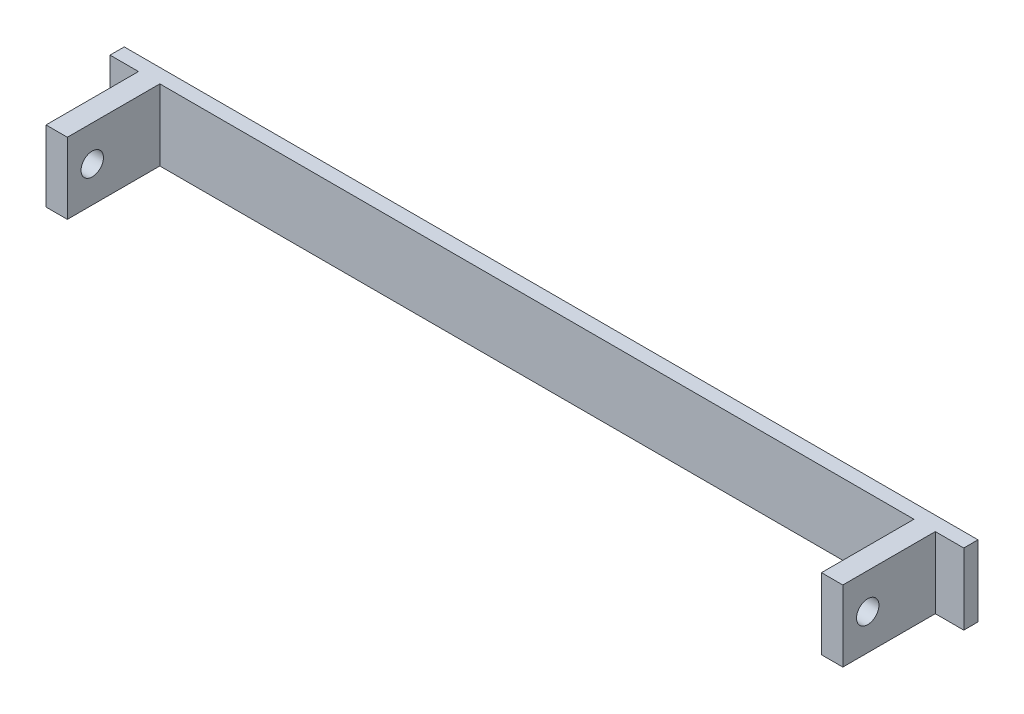
from build123d import *

# Parameters (mm, degrees)
SKETCH_1_W          = 120
SKETCH_1_H          = 10
EXTRUDE_1_DEPTH     = 2
SKETCH_2_W          = 3
SKETCH_2_H          = 10
EXTRUDE_2_DEPTH     = 13
CUT_EXTRUDE_1_REACH = 119.073
SKETCH_3_R          = 1.575


with BuildPart() as part:
    # 草图1 → 凸台-拉伸1 (new body)
    with BuildSketch(Plane.XY):
        Rectangle(SKETCH_1_W, SKETCH_1_H)
    extrude(amount=EXTRUDE_1_DEPTH)

    # 草图2 → 凸台-拉伸2 (add)
    with BuildSketch(Plane.XY.offset(2)):
        with Locations((-54.5, 0)):
            Rectangle(SKETCH_2_W, SKETCH_2_H)
        with Locations((54.5, 0)):
            Rectangle(SKETCH_2_W, SKETCH_2_H)
    extrude(amount=EXTRUDE_2_DEPTH)

    # 切除-拉伸1: up to this face of the body (flat: up to its plane)
    cut_extrude_1_end = Plane(part.part.faces().sort_by_distance((-56, 0, 8.5))[0])
    # 草图3 → 切除-拉伸1 (cut, up to the picked face)
    with BuildSketch(Plane(origin=(56, 0, 0), x_dir=(0, 0, -1), z_dir=(1, 0, 0)), mode=Mode.PRIVATE) as cut_extrude_1_sk1:
        with Locations(Location((-11.5, 0, 0), (0, 0, 90))):
            Circle(SKETCH_3_R)
    cut_extrude_1_tool1 = split(extrude(cut_extrude_1_sk1.sketch, amount=-CUT_EXTRUDE_1_REACH, mode=Mode.PRIVATE), bisect_by=cut_extrude_1_end, keep=Keep.BOTH, mode=Mode.PRIVATE)
    add(cut_extrude_1_tool1.solids().sort_by(Axis((56, 0, 11.5), (-1, 0, 0)))[0], mode=Mode.SUBTRACT)


solid = part.part
